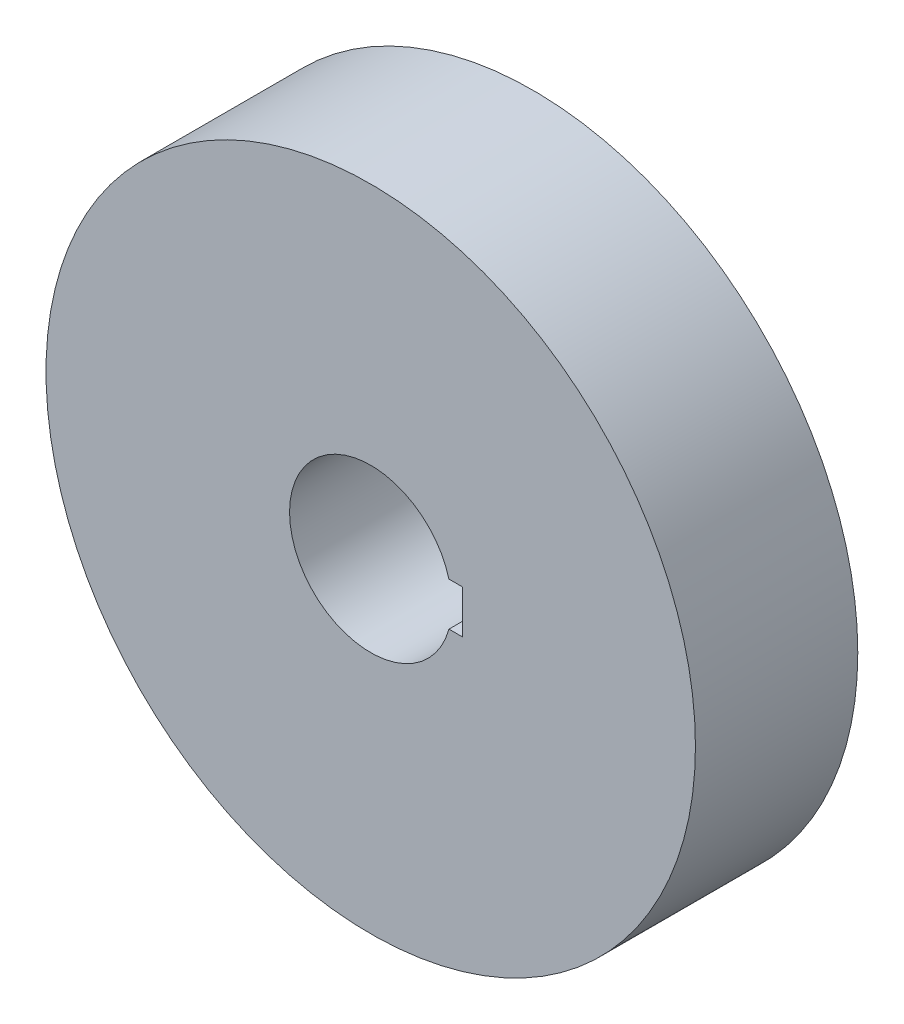
from build123d import *

# Parameters (mm, degrees)
SKETCH_1_R          = 30
EXTRUDE_1_DEPTH     = 7.5
CUT_EXTRUDE_1_DEPTH = 30


with BuildPart() as part:
    # 草图1 → 凸台-拉伸1 (new, symmetric)
    with BuildSketch(Plane.XY):
        Circle(SKETCH_1_R)
    extrude(amount=EXTRUDE_1_DEPTH, both=True)

    # 草图2 → 切除-拉伸1 (cut)
    with BuildSketch(Plane.XY.offset(7.5)):
        with BuildLine():
            Line((7.228416147, 2), (8.5, 2))
            Line((8.5, 2), (8.5, -2))
            Line((8.5, -2), (7.228416147, -2))
            ThreePointArc((7.228416147, -2), (-7.5, 0), (7.228416147, 2))
        make_face()
    extrude(amount=-CUT_EXTRUDE_1_DEPTH, mode=Mode.SUBTRACT)


solid = part.part
